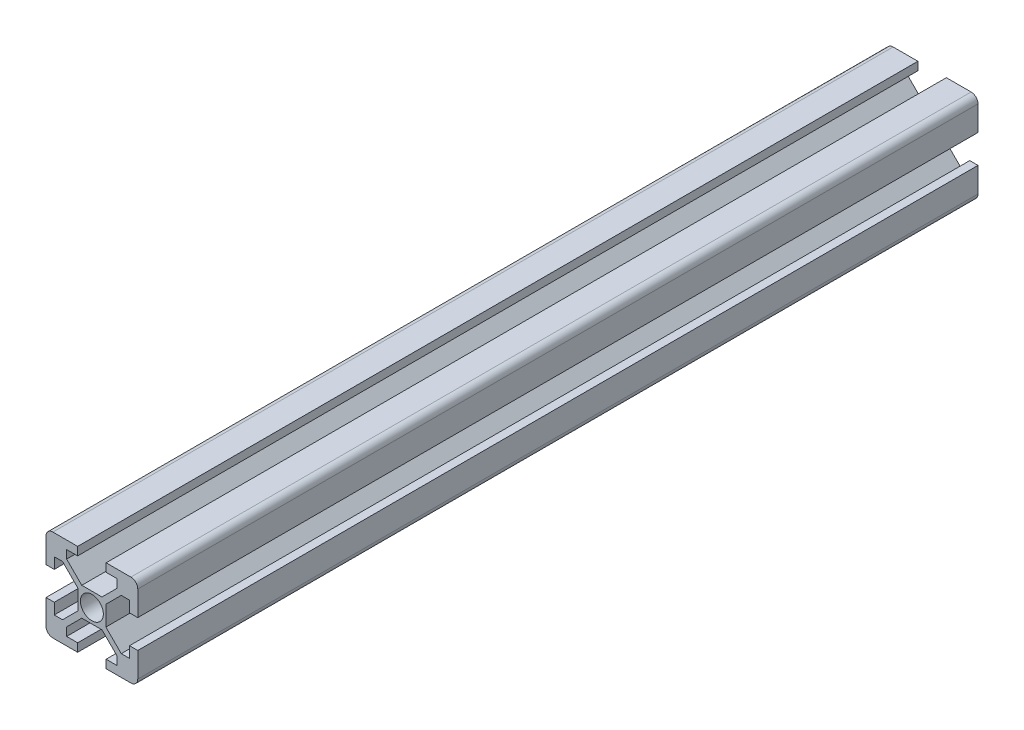
from build123d import *

# Parameters (mm, degrees)
SKETCH_1_R          = 2.5
EXTRUDE_1_DEPTH     = 950
SKETCH_2_W          = 109.948268043
SKETCH_2_H          = 29.443949836
CUT_EXTRUDE_1_DEPTH = 725.86
SKETCH_5_W          = 99.378556311
SKETCH_5_H          = 151.459473896
CUT_EXTRUDE_2_DEPTH = 41


with BuildPart() as part:
    # 草图1 → 凸台-拉伸1 (new body)
    with BuildSketch(Plane.XY):
        with BuildLine():
            Line((-8.2, -3.1), (-10, -3.1))
            Line((-10, -3.1), (-10, -8.5))
            ThreePointArc((-10, -8.5), (-9.560660172, -9.560660172), (-8.5, -10))
            Line((-8.5, -10), (-3.1, -10))
            Line((-3.1, -10), (-3.1, -8.2))
            Line((-3.1, -8.2), (-5.5, -8.2))
            Line((-5.5, -8.2), (-5.5, -6.397050155))
            Line((-5.5, -6.397050155), (-2.202949845, -3.1))
            Line((-2.202949845, -3.1), (2.202949845, -3.1))
            Line((2.202949845, -3.1), (5.5, -6.397050155))
            Line((5.5, -6.397050155), (5.5, -8.2))
            Line((5.5, -8.2), (3.1, -8.2))
            Line((3.1, -8.2), (3.1, -10))
            Line((3.1, -10), (8.5, -10))
            ThreePointArc((8.5, -10), (9.560660172, -9.560660172), (10, -8.5))
            Line((10, -8.5), (10, -3.1))
            Line((10, -3.1), (8.2, -3.1))
            Line((8.2, -3.1), (8.2, -5.5))
            Line((8.2, -5.5), (6.397050155, -5.5))
            Line((6.397050155, -5.5), (3.05412702, -2.157076865))
            Line((3.05412702, -2.157076865), (3.05412702, 2.157076865))
            Line((3.05412702, 2.157076865), (6.397050155, 5.5))
            Line((6.397050155, 5.5), (8.2, 5.5))
            Line((8.2, 5.5), (8.2, 3.1))
            Line((8.2, 3.1), (10, 3.1))
            Line((10, 3.1), (10, 8.5))
            ThreePointArc((10, 8.5), (9.560660172, 9.560660172), (8.5, 10))
            Line((8.5, 10), (3.1, 10))
            Line((3.1, 10), (3.1, 8.2))
            Line((3.1, 8.2), (5.5, 8.2))
            Line((5.5, 8.2), (5.5, 6.397050155))
            Line((5.5, 6.397050155), (2.202949845, 3.1))
            Line((2.202949845, 3.1), (-2.202949845, 3.1))
            Line((-2.202949845, 3.1), (-5.5, 6.397050155))
            Line((-5.5, 6.397050155), (-5.5, 8.2))
            Line((-5.5, 8.2), (-3.1, 8.2))
            Line((-3.1, 8.2), (-3.1, 10))
            Line((-3.1, 10), (-8.5, 10))
            ThreePointArc((-8.5, 10), (-9.560660172, 9.560660172), (-10, 8.5))
            Line((-10, 8.5), (-10, 3.1))
            Line((-10, 3.1), (-8.2, 3.1))
            Line((-8.2, 3.1), (-8.2, 5.5))
            Line((-8.2, 5.5), (-6.397050155, 5.5))
            Line((-6.397050155, 5.5), (-3.05412702, 2.157076865))
            Line((-3.05412702, 2.157076865), (-3.05412702, -2.157076865))
            Line((-3.05412702, -2.157076865), (-6.397050155, -5.5))
            Line((-6.397050155, -5.5), (-8.2, -5.5))
            Line((-8.2, -5.5), (-8.2, -3.1))
        make_face()
        with Locations(Location((0, 0, 0), (0, 0, 180))):
            Circle(SKETCH_1_R, mode=Mode.SUBTRACT)
    extrude(amount=EXTRUDE_1_DEPTH)

    # 草图2 → 切除-拉伸1 (cut)
    with BuildSketch(Plane.XY.offset(950)):
        with Locations((27.511129311, -2.182282155)):
            Rectangle(SKETCH_2_W, SKETCH_2_H)
    extrude(amount=-CUT_EXTRUDE_1_DEPTH, mode=Mode.SUBTRACT)

    # 草图5 → 切除-拉伸2 (cut)
    with BuildSketch(Plane(origin=(0, 0, 0), x_dir=(-1, 0, 0), z_dir=(0, 0, -1))):
        with Locations((35.202237194, -44.495814053)):
            Rectangle(SKETCH_5_W, SKETCH_5_H)
    extrude(amount=-CUT_EXTRUDE_2_DEPTH, mode=Mode.SUBTRACT)


solid = part.part
